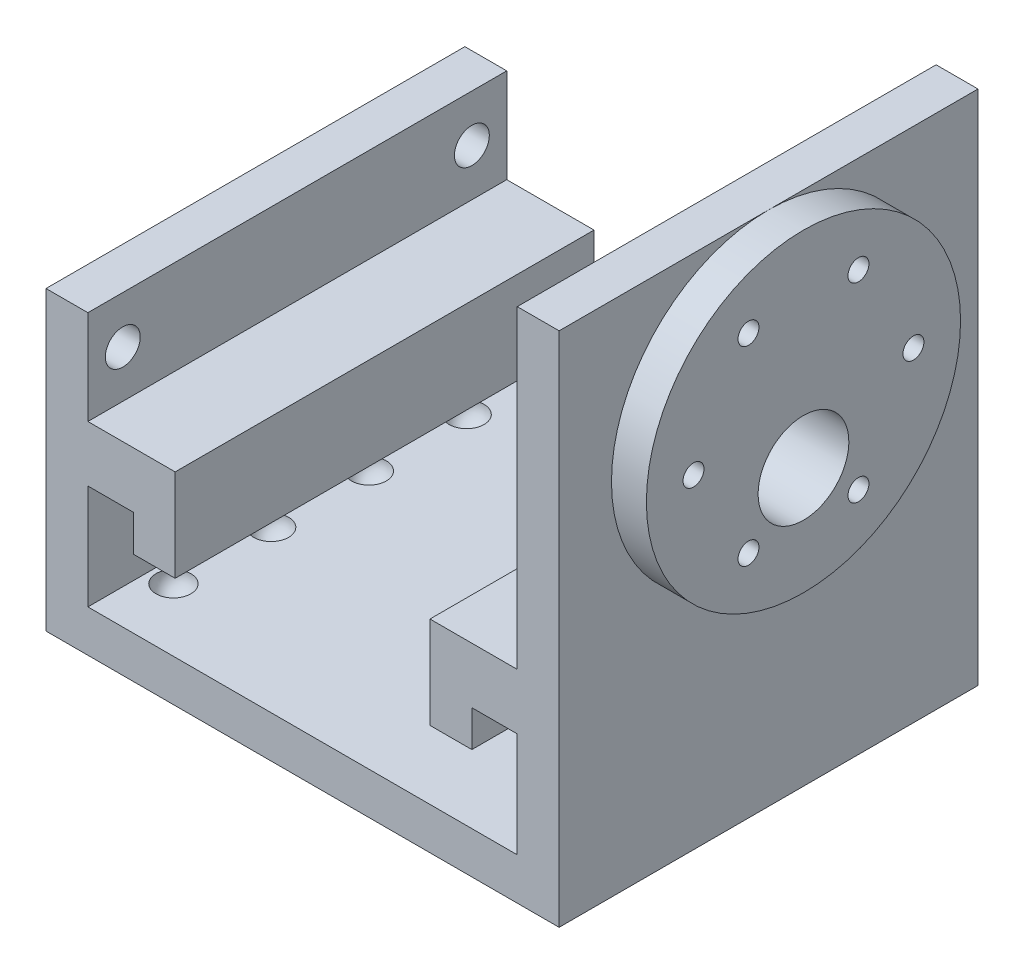
from build123d import *

# Parameters (mm, degrees)
BOSS_EXTRUDE1_DEPTH  = 60
SKETCH2_R            = 1.5
CUT_EXTRUDE1_DEPTH   = 6
LPATTERN1_COUNT      = 4
LPATTERN1_PITCH      = 14
LPATTERN1_COUNT_DIR2 = 2
LPATTERN1_PITCH_DIR2 = 55
CIRPATTERN2_COUNT    = 6
SKETCH10_R           = 6.5
CUT_EXTRUDE4_DEPTH   = 10
SKETCH11_R           = 22.5
SKETCH11_R_2         = 1.5
SKETCH11_R_3         = 6.5
BOSS_EXTRUDE6_DEPTH  = 5
SKETCH12_W           = 60
SKETCH12_H           = 13.5
SKETCH12_R           = 2.5
BOSS_EXTRUDE7_DEPTH  = 6


with BuildPart() as part:
    # Sketch1 → Boss-Extrude1 (new body)
    with BuildSketch(Plane.XY):
        Polygon((0, 29), (0, 0), (73.5, 0), (73.5, 74), (67.5, 74), (67.5, 29), (55, 29), (55, 15.8), (61, 15.8), (61, 21), (67.5, 21), (67.5, 6), (6, 6), (6, 21), (12.5, 21), (12.5, 15.8), (18.5, 15.8), (18.5, 29), align=None)
    extrude(amount=BOSS_EXTRUDE1_DEPTH)

    # Sketch2 → Cut-Extrude1 (cut)
    with BuildSketch(Plane.ZY.offset(-67.5)):
        with Locations(Location((45.75, 51.5, 0), (0, 0, 270))):
            Circle(SKETCH2_R)
    cut_extrude1 = extrude(amount=-CUT_EXTRUDE1_DEPTH, mode=Mode.SUBTRACT)

    # Sketch3 → Cut-Revolve1 (revolve, cut)
    with BuildSketch(Plane.XZ.offset(-21)):
        with BuildLine():
            Line((61.75, 51), (66.75, 51))
            ThreePointArc((66.75, 51), (64.25, 53.5), (61.75, 51))
        make_face()
    cut_revolve1 = revolve(axis=Axis((61.75, 21, 51), (1, 0, 0)), mode=Mode.SUBTRACT)

    # LPattern1: Cut-Revolve1 4 × 2
    with Locations(*[(-j * LPATTERN1_PITCH_DIR2, 0, -i * LPATTERN1_PITCH) for i in range(LPATTERN1_COUNT) for j in range(LPATTERN1_COUNT_DIR2) if (i, j) != (0, 0)]):
        add(cut_revolve1, mode=Mode.SUBTRACT)

    # CirPattern2: Cut-Extrude1 ×6 about axis
    cirpattern2_axis = Axis((0, 51.5, 30), (1, 0, 0))
    for i in range(1, CIRPATTERN2_COUNT):
        add(cut_extrude1.rotate(cirpattern2_axis, i * 360 / CIRPATTERN2_COUNT), mode=Mode.SUBTRACT)

    # Sketch10 → Cut-Extrude4 (cut)
    with BuildSketch(Plane.ZY.offset(-67.5)):
        with Locations((30, 44.5)):
            Circle(SKETCH10_R)
    extrude(amount=-CUT_EXTRUDE4_DEPTH, mode=Mode.SUBTRACT)

    # Sketch11 → Boss-Extrude6 (add)
    with BuildSketch(Plane(origin=(73.5, 0, 0), x_dir=(0, 0, -1), z_dir=(1, 0, 0))):
        with Locations(Location((-30, 51.5, 0), (0, 0, 90))):
            Circle(SKETCH11_R)
        with Locations(Location((-37.875, 65.1399, 0), (0, 0, 210))):
            Circle(SKETCH11_R_2, mode=Mode.SUBTRACT)
        with Locations(Location((-22.125, 65.1399, 0), (0, 0, 150))):
            Circle(SKETCH11_R_2, mode=Mode.SUBTRACT)
        with Locations(Location((-14.25, 51.5, 0), (0, 0, 90))):
            Circle(SKETCH11_R_2, mode=Mode.SUBTRACT)
        with Locations(Location((-22.125, 37.8601, 0), (0, 0, 90))):
            Circle(SKETCH11_R_2, mode=Mode.SUBTRACT)
        with Locations(Location((-30, 44.5, 0), (0, 0, 180))):
            Circle(SKETCH11_R_3, mode=Mode.SUBTRACT)
        with Locations(Location((-37.875, 37.8601, 0), (0, 0, 90))):
            Circle(SKETCH11_R_2, mode=Mode.SUBTRACT)
        with Locations(Location((-45.75, 51.5, 0), (0, 0, 270))):
            Circle(SKETCH11_R_2, mode=Mode.SUBTRACT)
    extrude(amount=BOSS_EXTRUDE6_DEPTH)

    # Sketch12 → Boss-Extrude7 (add)
    with BuildSketch(Plane(origin=(0, 0, 70), x_dir=(0, 0, -1), z_dir=(1, 0, 0))):
        with Locations((40, 35.75)):
            Rectangle(SKETCH12_W, SKETCH12_H)
        with Locations(Location((15, 35.75, 0), (0, 0, 270))):
            Circle(SKETCH12_R, mode=Mode.SUBTRACT)
        with Locations(Location((65, 35.75, 0), (0, 0, 270))):
            Circle(SKETCH12_R, mode=Mode.SUBTRACT)
    extrude(amount=BOSS_EXTRUDE7_DEPTH)

    # Mirror1: Cut-Revolve1 across plane
    add(cut_revolve1.mirror(Plane.ZX.offset(13.5)), mode=Mode.SUBTRACT)

    # Mirror1 copy 1 sketch → Mirror1 copy 1 (revolve, cut)
    with BuildSketch(Plane(origin=(-55, 6, 0), x_dir=(1, 0, 0), z_dir=(0, 1, 0))):
        with BuildLine():
            Line((61.75, -51), (66.75, -51))
            ThreePointArc((66.75, -51), (64.25, -53.5), (61.75, -51))
        make_face()
    revolve(axis=Axis((6.75, 6, 51), (-1, 0, 0)), mode=Mode.SUBTRACT)

    # Mirror1 copy 2 sketch → Mirror1 copy 2 (revolve, cut)
    with BuildSketch(Plane(origin=(0, 6, -14), x_dir=(1, 0, 0), z_dir=(0, 1, 0))):
        with BuildLine():
            Line((61.75, -51), (66.75, -51))
            ThreePointArc((66.75, -51), (64.25, -53.5), (61.75, -51))
        make_face()
    revolve(axis=Axis((61.75, 6, 37), (-1, 0, 0)), mode=Mode.SUBTRACT)

    # Mirror1 copy 3 sketch → Mirror1 copy 3 (revolve, cut)
    with BuildSketch(Plane(origin=(-55, 6, -14), x_dir=(1, 0, 0), z_dir=(0, 1, 0))):
        with BuildLine():
            Line((61.75, -51), (66.75, -51))
            ThreePointArc((66.75, -51), (64.25, -53.5), (61.75, -51))
        make_face()
    revolve(axis=Axis((6.75, 6, 37), (-1, 0, 0)), mode=Mode.SUBTRACT)

    # Mirror1 copy 4 sketch → Mirror1 copy 4 (revolve, cut)
    with BuildSketch(Plane(origin=(0, 6, -28), x_dir=(1, 0, 0), z_dir=(0, 1, 0))):
        with BuildLine():
            Line((61.75, -51), (66.75, -51))
            ThreePointArc((66.75, -51), (64.25, -53.5), (61.75, -51))
        make_face()
    revolve(axis=Axis((61.75, 6, 23), (-1, 0, 0)), mode=Mode.SUBTRACT)

    # Mirror1 copy 5 sketch → Mirror1 copy 5 (revolve, cut)
    with BuildSketch(Plane(origin=(-55, 6, -28), x_dir=(1, 0, 0), z_dir=(0, 1, 0))):
        with BuildLine():
            Line((61.75, -51), (66.75, -51))
            ThreePointArc((66.75, -51), (64.25, -53.5), (61.75, -51))
        make_face()
    revolve(axis=Axis((6.75, 6, 23), (-1, 0, 0)), mode=Mode.SUBTRACT)

    # Mirror1 copy 6 sketch → Mirror1 copy 6 (revolve, cut)
    with BuildSketch(Plane(origin=(0, 6, -42), x_dir=(1, 0, 0), z_dir=(0, 1, 0))):
        with BuildLine():
            Line((61.75, -51), (66.75, -51))
            ThreePointArc((66.75, -51), (64.25, -53.5), (61.75, -51))
        make_face()
    revolve(axis=Axis((61.75, 6, 9), (-1, 0, 0)), mode=Mode.SUBTRACT)

    # Mirror1 copy 7 sketch → Mirror1 copy 7 (revolve, cut)
    with BuildSketch(Plane(origin=(-55, 6, -42), x_dir=(1, 0, 0), z_dir=(0, 1, 0))):
        with BuildLine():
            Line((61.75, -51), (66.75, -51))
            ThreePointArc((66.75, -51), (64.25, -53.5), (61.75, -51))
        make_face()
    revolve(axis=Axis((6.75, 6, 9), (-1, 0, 0)), mode=Mode.SUBTRACT)


solid = part.part
